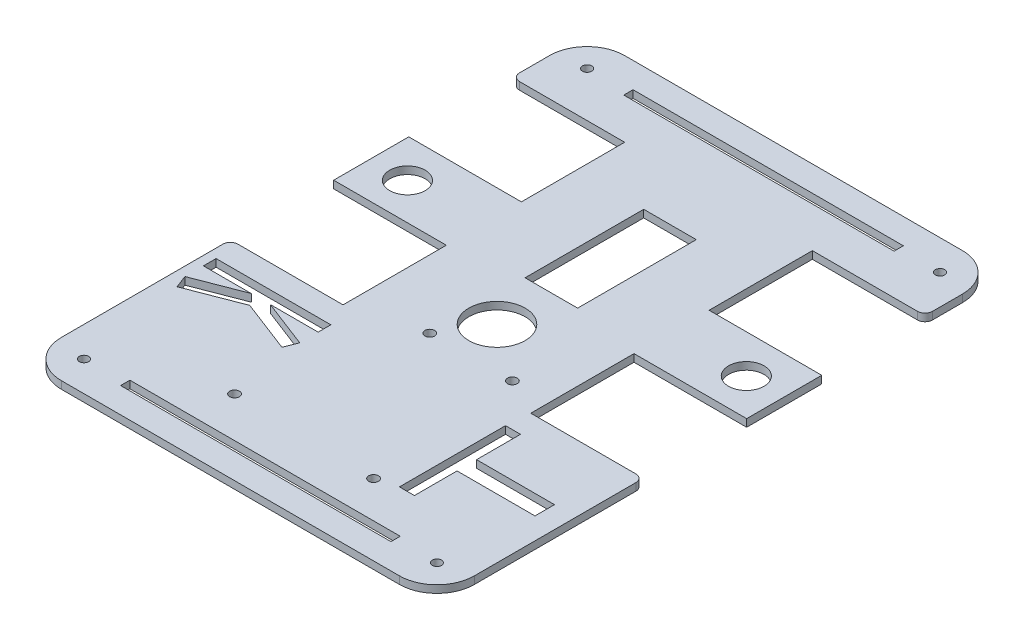
from build123d import *

# Parameters (mm, degrees)
SKETCH2_W                    = 139.7
SKETCH2_H                    = 190.5
BASE_PLATE_DEPTH             = 2.54
SKETCH5_W                    = 38.1
SKETCH5_H                    = 95.25
STEERING_WHEELS_HOLES_DEPTH  = 6.35
FILLET1_R                    = 12.7
FILLET2_R                    = 2.54
SKETCH18_R                   = 1.651
HOLES_FOR_ARDUINO_UNO_DEPTH  = 119.144134852
SKETCH20_R                   = 9.525
CUTOUT_FOR_MOTOR_WIRES_DEPTH = 119.144134852
SKETCH24_R                   = 1.57
CUT_EXTRUDE1_DEPTH           = 2.54
SKETCH25_R                   = 1.57
CUT_EXTRUDE3_DEPTH           = 2.54
SKETCH27_W                   = 91.44
SKETCH27_H                   = 3.14
CUT_EXTRUDE4_DEPTH           = 2.54
SKETCH28_W                   = 38.1
SKETCH28_H                   = 25.4
BOSS_EXTRUDE1_DEPTH          = 2.54
SKETCH29_R                   = 6
CUT_EXTRUDE5_DEPTH           = 119.144134852
SKETCH30_W                   = 17.78
SKETCH30_H                   = 40.132
CUT_EXTRUDE6_DEPTH           = 119.144134852
CUT_EXTRUDE7_DEPTH           = 2.54


with BuildPart() as part:
    # Sketch2 → Base Plate (new body)
    with BuildSketch(Plane(origin=(0, 0, 0), x_dir=(1, 0, 0), z_dir=(0, 1, 0))):
        Rectangle(SKETCH2_W, SKETCH2_H)
    extrude(amount=BASE_PLATE_DEPTH)

    # Sketch5 → Steering Wheels Holes (cut)
    with BuildSketch(Plane(origin=(0, 2.54, 0), x_dir=(1, 0, 0), z_dir=(0, 1, 0))):
        with Locations((-50.8, 22.225)):
            Rectangle(SKETCH5_W, SKETCH5_H)
        with Locations((50.8, 22.225)):
            Rectangle(SKETCH5_W, SKETCH5_H)
    extrude(amount=-STEERING_WHEELS_HOLES_DEPTH, mode=Mode.SUBTRACT)

    # Fillet1
    fillet1_edges = [part.edges().sort_by_distance(p)[0] for p in [
        (69.85, 1.27, 95.25),
        (-69.85, 1.27, 95.25),
        (-69.85, 1.27, -95.25),
        (69.85, 1.27, -95.25),
    ]]
    fillet(fillet1_edges, radius=FILLET1_R)

    # Fillet2
    fillet2_edges = [part.edges().sort_by_distance(p)[0] for p in [
        (-69.85, 1.27, 25.4),
        (-69.85, 1.27, -69.85),
        (69.85, 1.27, -69.85),
        (69.85, 1.27, 25.4),
    ]]
    fillet(fillet2_edges, radius=FILLET2_R)

    # Sketch18 → Holes for Arduino UNO (cut, through all)
    with BuildSketch(Plane(origin=(0, 2.54, 0), x_dir=(1, 0, 0), z_dir=(0, 1, 0))):
        with Locations(Location((-8.763, -19.05, 0), (0, 0, 270))):
            Circle(SKETCH18_R)
        with Locations(Location((19.177, -19.05, 0), (0, 0, 270))):
            Circle(SKETCH18_R)
        with Locations(Location((-24.003, -69.85, 0), (0, 0, 270))):
            Circle(SKETCH18_R)
        with Locations(Location((24.309664393, -71.12, 0), (0, 0, 270))):
            Circle(SKETCH18_R)
    extrude(amount=-HOLES_FOR_ARDUINO_UNO_DEPTH, mode=Mode.SUBTRACT)

    # Sketch20 → Cutout for motor wires (cut, through all)
    with BuildSketch(Plane(origin=(0, 2.54, 0), x_dir=(1, 0, 0), z_dir=(0, 1, 0))):
        with Locations(Location((0, -5.08, 0), (0, 0, 270))):
            Circle(SKETCH20_R)
    extrude(amount=-CUTOUT_FOR_MOTOR_WIRES_DEPTH, mode=Mode.SUBTRACT)

    # Sketch24 → Cut-Extrude1 (cut)
    with BuildSketch(Plane(origin=(0, 2.54, 0), x_dir=(1, 0, 0), z_dir=(0, 1, 0))):
        with Locations(Location((-59.69, 85.09, 0), (0, 0, 270))):
            Circle(SKETCH24_R)
    cut_extrude1 = extrude(amount=-CUT_EXTRUDE1_DEPTH, mode=Mode.SUBTRACT)

    # Mirror1: Cut-Extrude1 across plane
    add(cut_extrude1.mirror(Plane(origin=(0, 0, 0), x_dir=(0, 0, 1), z_dir=(1, 0, 0))), mode=Mode.SUBTRACT)

    # Sketch25 → Cut-Extrude3 (cut)
    with BuildSketch(Plane(origin=(0, 2.54, 0), x_dir=(1, 0, 0), z_dir=(0, 1, 0))):
        with Locations(Location((-59.69, -85.09, 0), (0, 0, 270))):
            Circle(SKETCH25_R)
        with Locations(Location((59.69, -85.09, 0), (0, 0, 90))):
            Circle(SKETCH25_R)
    extrude(amount=-CUT_EXTRUDE3_DEPTH, mode=Mode.SUBTRACT)

    # Sketch27 → Cut-Extrude4 (cut)
    with BuildSketch(Plane(origin=(0, 2.54, 0), x_dir=(1, 0, 0), z_dir=(0, 1, 0))):
        with Locations((0, -85.09)):
            Rectangle(SKETCH27_W, SKETCH27_H)
        with Locations((0, 85.09)):
            Rectangle(SKETCH27_W, SKETCH27_H)
    extrude(amount=-CUT_EXTRUDE4_DEPTH, mode=Mode.SUBTRACT)

    # Sketch28 → Boss-Extrude1 (add, through all)
    with BuildSketch(Plane(origin=(0, 2.54, 0), x_dir=(1, 0, 0), z_dir=(0, 1, 0))):
        with Locations((-50.8, 22.225)):
            Rectangle(SKETCH28_W, SKETCH28_H)
    boss_extrude1 = extrude(amount=-BOSS_EXTRUDE1_DEPTH)

    # Mirror2: Boss-Extrude1 across plane
    add(boss_extrude1.mirror(Plane(origin=(0, 0, 0), x_dir=(0, 0, 1), z_dir=(1, 0, 0))))

    # Sketch29 → Cut-Extrude5 (cut, through all)
    with BuildSketch(Plane.XZ):
        with Locations(Location((-57.3106296, -21.945186919, 0), (0, 0, 270))):
            Circle(SKETCH29_R)
    cut_extrude5 = extrude(amount=-CUT_EXTRUDE5_DEPTH, mode=Mode.SUBTRACT)

    # Mirror3: Cut-Extrude5 across plane
    add(cut_extrude5.mirror(Plane(origin=(0, 0, 0), x_dir=(0, 0, 1), z_dir=(1, 0, 0))), mode=Mode.SUBTRACT)

    # Sketch30 → Cut-Extrude6 (cut, through all)
    with BuildSketch(Plane.XZ):
        with Locations((0, -33.375186919)):
            Rectangle(SKETCH30_W, SKETCH30_H)
    extrude(amount=-CUT_EXTRUDE6_DEPTH, mode=Mode.SUBTRACT)

    # Sketch31 → Cut-Extrude7 (cut)
    with BuildSketch(Plane.XZ):
        Polygon((-66.782826822, 33.314746009), (-27.963596323, 33.314746009), (-27.963596323, 37.60631923), (-44.154531657, 37.60631923), (-27.963596323, 43.848607552), (-29.63125682, 48.174101966), (-47.373211572, 41.333830254), (-65.115166325, 48.174101966), (-66.782826822, 43.848607552), (-50.591891488, 37.60631923), (-66.782826822, 37.60631923), align=None)
        Polygon((31.121508027, 33.314746009), (36.190157542, 33.314746009), (36.190157542, 48.174101966), (62.547135024, 48.174101966), (62.547135024, 54.772612114), (36.190157542, 54.772612114), (36.190157542, 69.200784581), (31.121508027, 69.200784581), align=None)
    extrude(amount=-CUT_EXTRUDE7_DEPTH, mode=Mode.SUBTRACT)


solid = part.part
